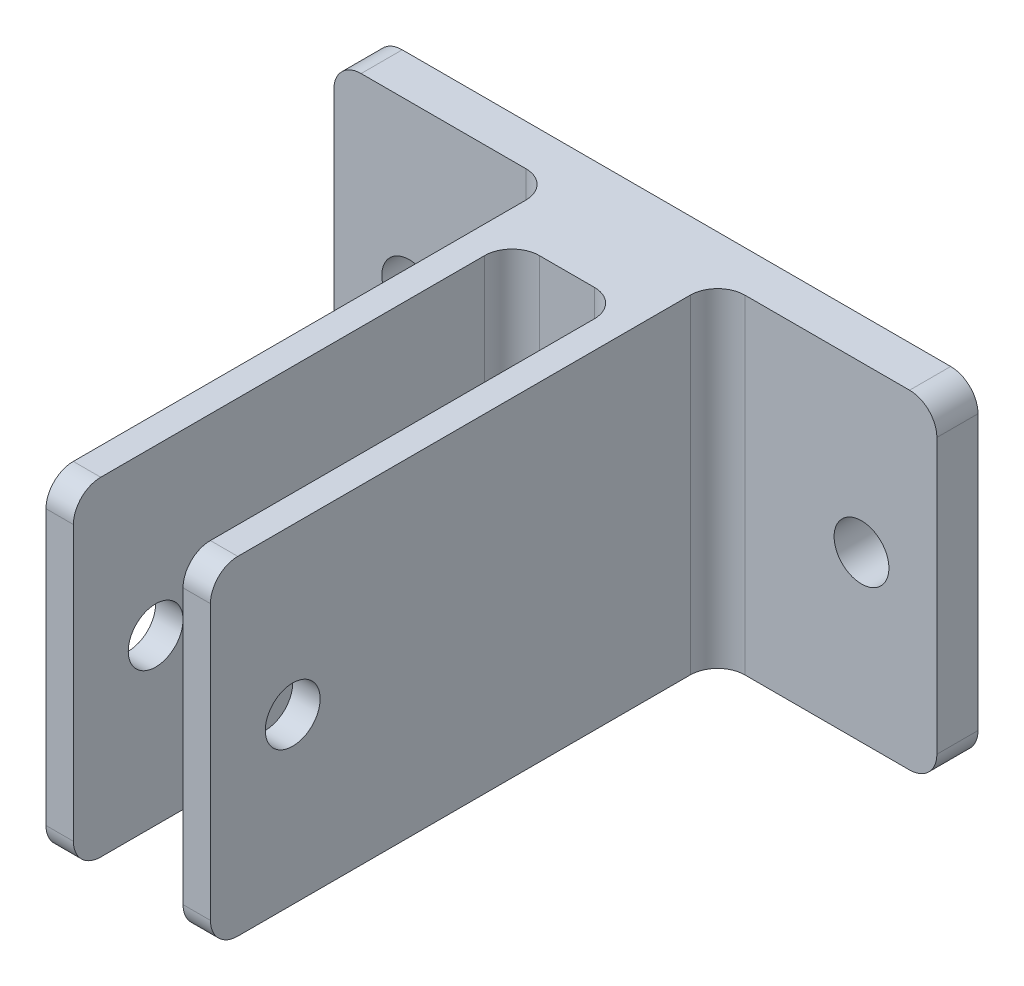
from build123d import *

# Parameters (mm, degrees)
EXTRUDE1_DEPTH      = 19.05
SKETCH2_R           = 3.175
EXTRUDE2_DEPTH      = 75.93269063
EXTRUDE3_DEPTH      = 76.501141892
EXTRUDE3_DEPTH_BACK = 76.501141892
SKETCH3_R           = 3.175
FILLET3_R           = 3.1623


with BuildPart() as part:
    # Sketch1 → Extrude1 (new, symmetric)
    with BuildSketch(Plane(origin=(0, 0, 0), x_dir=(1, 0, 0), z_dir=(0, 1, 0))):
        Polygon((-34.925, 0), (34.925, 0), (34.925, -4.7625), (9.525, -4.7625), (9.525, -63.5), (6.35, -63.5), (6.35, -12.7), (-6.35, -12.7), (-6.35, -63.5), (-9.525, -63.5), (-9.525, -4.7625), (-34.925, -4.7625), align=None)
    extrude(amount=EXTRUDE1_DEPTH, both=True)

    # Sketch2 → Extrude2 (cut, through all)
    with BuildSketch(Plane.XY):
        with Locations(Location((-26.19375, 0, 0), (0, 0, 180))):
            Circle(SKETCH2_R)
        with Locations(Location((26.19375, 0, 0), (0, 0, 180))):
            Circle(SKETCH2_R)
    extrude(amount=EXTRUDE2_DEPTH, mode=Mode.SUBTRACT)

    # Sketch3 → Extrude3 (cut, two sides: drawn at the far end of the back side and taken through both)
    with BuildSketch(Plane(origin=(0, 0, -0.669808337), x_dir=(0, 0, -1), z_dir=(1, 0, 0)).offset(-EXTRUDE3_DEPTH_BACK)):
        with Locations(Location((-54.644808337, 0, 0), (0, 0, 180))):
            Circle(SKETCH3_R)
    extrude(amount=EXTRUDE3_DEPTH + EXTRUDE3_DEPTH_BACK, mode=Mode.SUBTRACT)

    # Fillet3
    fillet3_edges = [part.edges().sort_by_distance(p)[0] for p in [
        (-34.925, 19.05, 2.38125),
        (7.9375, -19.05, 63.5),
        (-7.9375, -19.05, 63.5),
        (-34.925, -19.05, 2.38125),
        (34.925, -19.05, 2.38125),
        (-7.9375, 19.05, 63.5),
        (9.525, 0, 4.7625),
        (6.35, 0, 12.7),
        (-6.35, 0, 12.7),
        (-9.525, 0, 4.7625),
        (7.9375, 19.05, 63.5),
        (34.925, 19.05, 2.38125),
    ]]
    fillet(fillet3_edges, radius=FILLET3_R)


solid = part.part
